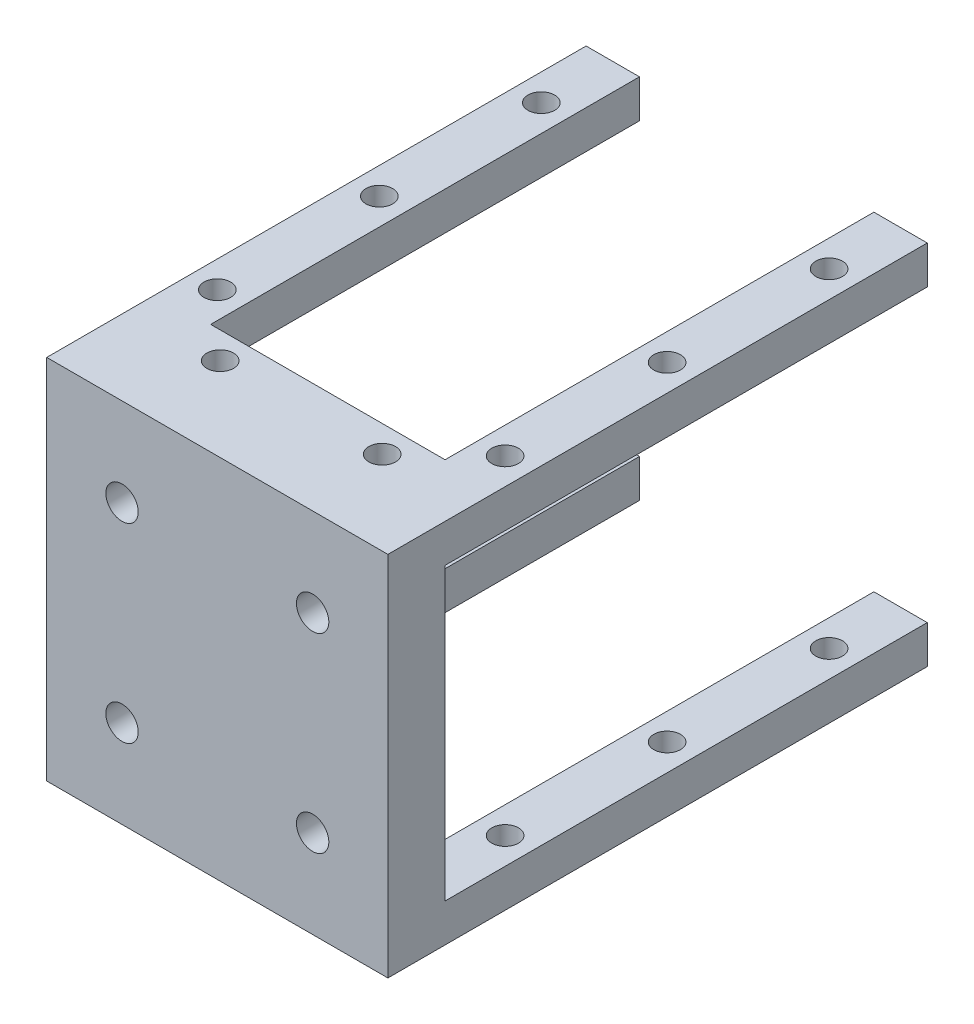
from build123d import *

# Parameters (mm, degrees)
SKETCH1_R           = 1.4
BOSS_EXTRUDE1_DEPTH = 4
SKETCH2_R           = 1.4
BOSS_EXTRUDE2_DEPTH = 4
SKETCH3_W           = 35.8
SKETCH3_H           = 38.5
BOSS_EXTRUDE3_DEPTH = 6
CUT_EXTRUDE1_DEPTH  = 3.5
SKETCH5_R           = 1.7
CUT_EXTRUDE3_DEPTH  = 67.053160409


with BuildPart() as part:
    # Sketch1 → Boss-Extrude1 (new body)
    with BuildSketch(Plane(origin=(0, 0, 0), x_dir=(1, 0, 0), z_dir=(0, 1, 0))):
        Polygon((-17.9, 45), (-17.9, -5.6), (17.9, -5.6), (17.9, 45), (12.3, 45), (12.3, 0), (-12.3, 0), (-12.3, 45), align=None)
        with Locations(Location((-8.5, -2.8, 0), (0, 0, 270))):
            Circle(SKETCH1_R, mode=Mode.SUBTRACT)
        with Locations(Location((8.5, -2.8, 0), (0, 0, 90))):
            Circle(SKETCH1_R, mode=Mode.SUBTRACT)
        with Locations(Location((15.1, 37.5, 0), (0, 0, 270))):
            Circle(SKETCH1_R, mode=Mode.SUBTRACT)
        with Locations(Location((15.1, 20.5, 0), (0, 0, 270))):
            Circle(SKETCH1_R, mode=Mode.SUBTRACT)
        with Locations(Location((15.1, 3.5, 0), (0, 0, 270))):
            Circle(SKETCH1_R, mode=Mode.SUBTRACT)
        with Locations(Location((-15.1, 3.5, 0), (0, 0, 90))):
            Circle(SKETCH1_R, mode=Mode.SUBTRACT)
        with Locations(Location((-15.1, 20.5, 0), (0, 0, 90))):
            Circle(SKETCH1_R, mode=Mode.SUBTRACT)
        with Locations(Location((-15.1, 37.5, 0), (0, 0, 90))):
            Circle(SKETCH1_R, mode=Mode.SUBTRACT)
    extrude(amount=BOSS_EXTRUDE1_DEPTH)



with BuildPart() as body_2:
    # Sketch2 → Boss-Extrude2 (new body)
    with BuildSketch(Plane(origin=(0, 34.5, 0), x_dir=(1, 0, 0), z_dir=(0, 1, 0))):
        Polygon((-17.9, -5.6), (17.9, -5.6), (17.9, 45), (12.3, 45), (12.3, 0), (-12.3, 0), (-12.3, 45), (-17.9, 45), align=None)
        with Locations(Location((8.5, -2.8, 0), (0, 0, 90))):
            Circle(SKETCH2_R, mode=Mode.SUBTRACT)
        with Locations(Location((-8.5, -2.8, 0), (0, 0, 270))):
            Circle(SKETCH2_R, mode=Mode.SUBTRACT)
        with Locations(Location((-15.1, 3.5, 0), (0, 0, 90))):
            Circle(SKETCH2_R, mode=Mode.SUBTRACT)
        with Locations(Location((-15.1, 20.5, 0), (0, 0, 90))):
            Circle(SKETCH2_R, mode=Mode.SUBTRACT)
        with Locations(Location((15.1, 3.5, 0), (0, 0, 270))):
            Circle(SKETCH2_R, mode=Mode.SUBTRACT)
        with Locations(Location((15.1, 20.5, 0), (0, 0, 270))):
            Circle(SKETCH2_R, mode=Mode.SUBTRACT)
        with Locations(Location((15.1, 37.5, 0), (0, 0, 270))):
            Circle(SKETCH2_R, mode=Mode.SUBTRACT)
        with Locations(Location((-15.1, 37.5, 0), (0, 0, 90))):
            Circle(SKETCH2_R, mode=Mode.SUBTRACT)
    extrude(amount=BOSS_EXTRUDE2_DEPTH)


with BuildPart() as part_1:
    add(part.part)

    add(body_2.part)  # Boss-Extrude3 merges body 2
    # Sketch3 → Boss-Extrude3 (add)
    with BuildSketch(Plane.XY.offset(5.6)):
        with Locations((0, 19.25)):
            Rectangle(SKETCH3_W, SKETCH3_H)
    extrude(amount=BOSS_EXTRUDE3_DEPTH)

    # Sketch4 → Cut-Extrude1 (cut)
    with BuildSketch(Plane(origin=(0, 0, 5.6), x_dir=(-1, 0, 0), z_dir=(0, 0, -1))):
        Polygon((8.325684219, 26.35), (6.651368439, 29.25), (8.325684219, 32.15), (11.674315781, 32.15), (13.348631561, 29.25), (11.674315781, 26.35), align=None)
        Polygon((-8.325684219, 26.35), (-6.651368439, 29.25), (-8.325684219, 32.15), (-11.674315781, 32.15), (-13.348631561, 29.25), (-11.674315781, 26.35), align=None)
        Polygon((6.651368439, 9.25), (8.325684219, 6.35), (11.674315781, 6.35), (13.348631561, 9.25), (11.674315781, 12.15), (8.325684219, 12.15), align=None)
        Polygon((-6.651368439, 9.25), (-8.325684219, 6.35), (-11.674315781, 6.35), (-13.348631561, 9.25), (-11.674315781, 12.15), (-8.325684219, 12.15), align=None)
    extrude(amount=-CUT_EXTRUDE1_DEPTH, mode=Mode.SUBTRACT)

    # Sketch5 → Cut-Extrude3 (cut, through all)
    with BuildSketch(Plane(origin=(0, 0, 5.6), x_dir=(-1, 0, 0), z_dir=(0, 0, -1))):
        with Locations((-10, 29.25)):
            Circle(SKETCH5_R)
        with Locations((-10, 9.25)):
            Circle(SKETCH5_R)
        with Locations((10, 9.25)):
            Circle(SKETCH5_R)
        with Locations((10, 29.25)):
            Circle(SKETCH5_R)
    extrude(amount=-CUT_EXTRUDE3_DEPTH, mode=Mode.SUBTRACT)


solid = part_1.part
